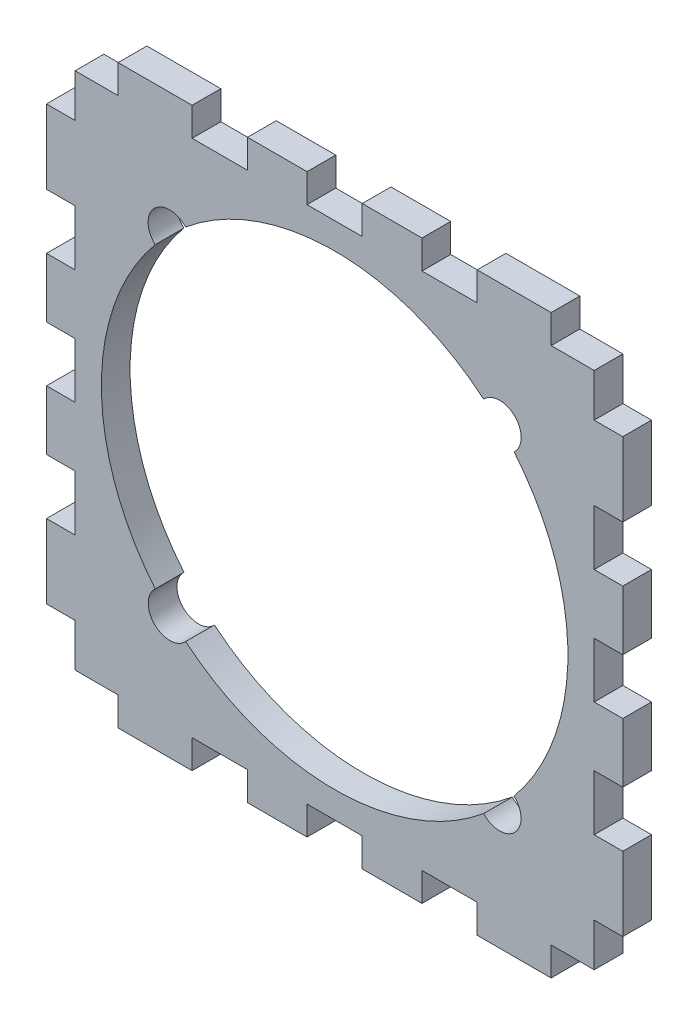
from build123d import *

# Parameters (mm, degrees)
BOSS_EXTRUDE1_DEPTH = 4


with BuildPart() as part:
    # Model → Boss-Extrude1 (new body)
    with BuildSketch(Plane.XY):
        Polygon((-5.997220875, 216.82832197), (1.346e-06, 216.82832197), (1.346e-06, 220.814711934), (10.301111378, 220.814711934), (10.301111378, 216.82832197), (18.026945247, 216.82832197), (18.026945247, 220.814711934), (26.31722235, 220.814711934), (26.31722235, 216.82832197), (34.007778034, 216.82832197), (34.007778034, 220.814711934), (42.333333323, 220.814711934), (42.333333323, 216.82832197), (50.023888607, 216.82832197), (50.023888607, 220.814711934), (60.325001331, 220.814711934), (60.325001331, 216.82832197), (66.322223551, 216.82832197), (66.322223551, 210.831099749), (70.308610824, 210.831099749), (70.308610824, 200.529989717), (66.322223551, 200.529989717), (66.322223551, 192.80415652), (70.308610824, 192.80415652), (70.308610824, 184.513878576), (66.322223551, 184.513878576), (66.322223551, 176.823322787), (70.308610824, 176.823322787), (70.308610824, 168.533045011), (66.322223551, 168.533045011), (66.322223551, 160.807212487), (70.308610824, 160.807212487), (70.308610824, 150.506099764), (66.322223551, 150.506099764), (66.322223551, 144.508877543), (60.325001331, 144.508877543), (60.325001331, 140.522487579), (50.023888607, 140.522487579), (50.023888607, 144.508877543), (42.333333323, 144.508877543), (42.333333323, 140.522487579), (34.007778034, 140.522487579), (34.007778034, 144.508877543), (26.31722235, 144.508877543), (26.31722235, 140.522487579), (18.026945247, 140.522487579), (18.026945247, 144.508877543), (10.301111378, 144.508877543), (10.301111378, 140.522487579), (1.346e-06, 140.522487579), (1.346e-06, 144.508877543), (-5.997220875, 144.508877543), (-5.997220875, 150.506099764), (-9.983610839, 150.506099764), (-9.983610839, 160.807212487), (-5.997220875, 160.807212487), (-5.997220875, 168.533045011), (-9.983610839, 168.533045011), (-9.983610839, 176.823322787), (-5.997220875, 176.823322787), (-5.997220875, 184.513878576), (-9.983610839, 184.513878576), (-9.983610839, 192.80415652), (-5.997220875, 192.80415652), (-5.997220875, 200.529989717), (-9.983610839, 200.529989717), (-9.983610839, 210.831099749), (-5.997220875, 210.831099749), align=None)
        with BuildLine():
            ThreePointArc((5.152925749, 201.423626349), (-2.337496568, 180.656932441), (5.167834069, 159.895621923))
            ThreePointArc((5.167834069, 159.895621923), (5.069223804, 155.557299062), (9.407474746, 155.659024168))
            ThreePointArc((9.407474746, 155.659024168), (30.162501338, 148.168599756), (50.917527931, 155.659024168))
            ThreePointArc((50.917527931, 155.659024168), (55.255778873, 155.557299062), (55.157168608, 159.895621923))
            ThreePointArc((55.157168608, 159.895621923), (62.662499244, 180.656932441), (55.172076927, 201.423626349))
            ThreePointArc((55.172076927, 201.423626349), (55.273802033, 205.761877291), (50.935479172, 205.663267026))
            ThreePointArc((50.935479172, 205.663267026), (30.162501338, 213.168599756), (9.389523504, 205.663267026))
            ThreePointArc((9.389523504, 205.663267026), (5.051200643, 205.761877291), (5.152925749, 201.423626349))
        make_face(mode=Mode.SUBTRACT)
    extrude(amount=BOSS_EXTRUDE1_DEPTH)


solid = part.part
